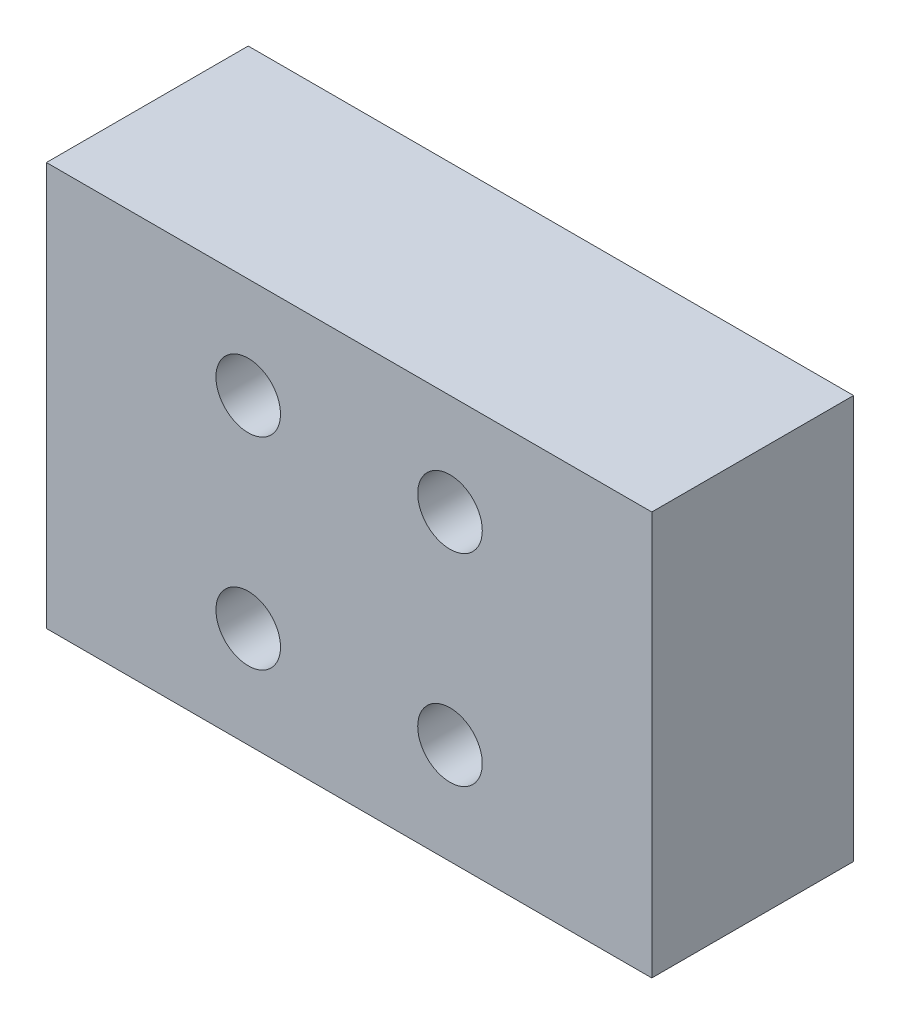
from build123d import *

# Parameters (mm, degrees)
SKETCH_1_W          = 30
SKETCH_1_H          = 20
EXTRUDE_1_DEPTH     = 10
SKETCH_2_R          = 1.6
CUT_EXTRUDE_1_DEPTH = 38.416573868


with BuildPart() as part:
    # 草图1 → 凸台-拉伸1 (new body)
    with BuildSketch(Plane.XY):
        with Locations((15, -10)):
            Rectangle(SKETCH_1_W, SKETCH_1_H)
    extrude(amount=EXTRUDE_1_DEPTH)

    # 草图2 → 切除-拉伸1 (cut, through all)
    with BuildSketch(Plane.XY.offset(10)):
        with Locations(Location((10, -5, 0), (0, 0, 180))):
            Circle(SKETCH_2_R)
        with Locations((10, -15)):
            Circle(SKETCH_2_R)
        with Locations(Location((20, -15, 0), (0, 0, 180))):
            Circle(SKETCH_2_R)
        with Locations((20, -5)):
            Circle(SKETCH_2_R)
    extrude(amount=-CUT_EXTRUDE_1_DEPTH, mode=Mode.SUBTRACT)


solid = part.part
